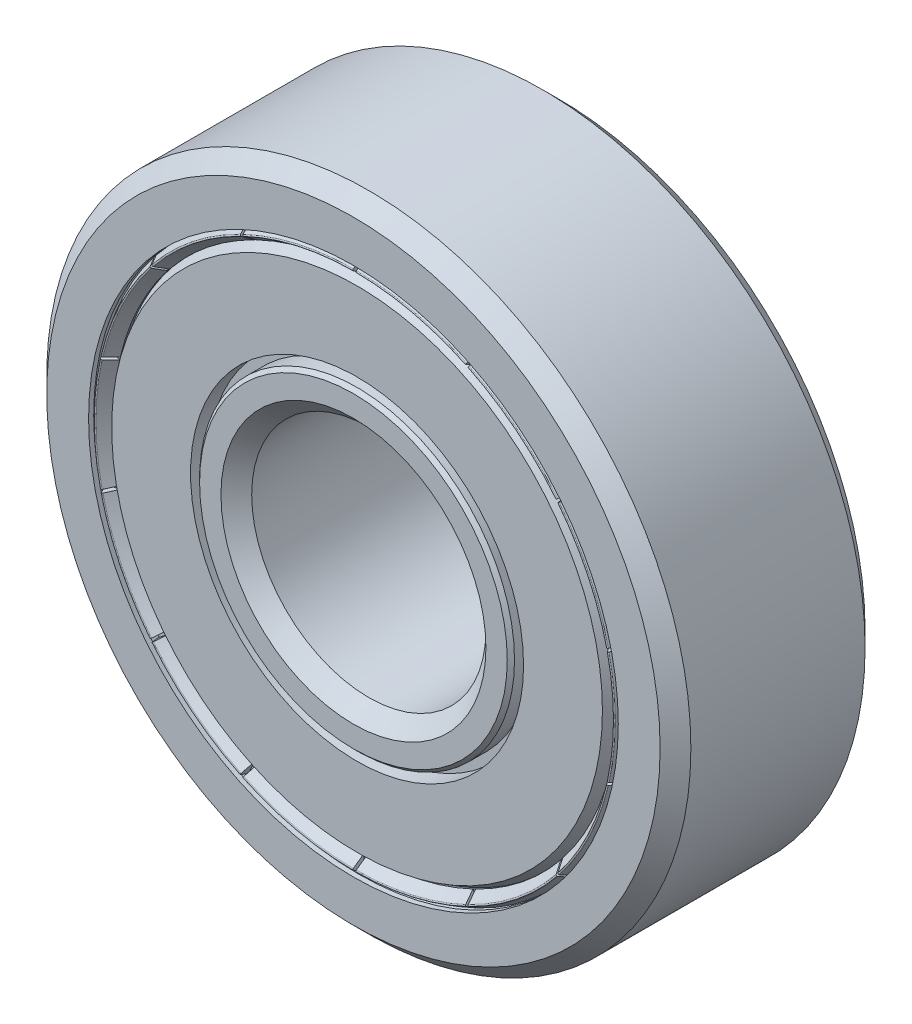
from build123d import *

# Parameters (mm, degrees)
CIRPATTERN1_COUNT  = 7
FILLET1_R          = 0.035
CUT_EXTRUDE1_START = 3.094142
CUT_EXTRUDE1_DEPTH = 13.851076719
CIRPATTERN2_COUNT  = 14


with BuildPart() as part:
    # Sketch3 → Revolve1 (revolve)
    with BuildSketch(Plane(origin=(0, 0, 0), x_dir=(0, 0, -1), z_dir=(1, 0, 0)), mode=Mode.PRIVATE) as revolve1_sk:
        with BuildLine():
            Line((2.975, 11), (-2.975, 11))
            Line((-2.975, 11), (-3.5, 10.475))
            Line((-3.5, 10.475), (-3.5, 9.046037105))
            Line((-3.5, 9.046037105), (-3.325, 9.046037105))
            Line((-3.325, 9.046037105), (-3.325, 9.498018553))
            Line((-3.325, 9.498018553), (-3.201256313, 9.621762239))
            Line((-3.201256313, 9.621762239), (-1.225, 9.621762239))
            ThreePointArc((-1.225, 9.621762239), (0, 9.95), (1.225, 9.621762239))
            Line((1.225, 9.621762239), (3.201256313, 9.621762239))
            Line((3.201256313, 9.621762239), (3.325, 9.498018553))
            Line((3.325, 9.498018553), (3.325, 9.046037105))
            Line((3.325, 9.046037105), (3.5, 9.046037105))
            Line((3.5, 9.046037105), (3.5, 10.475))
            Line((3.5, 10.475), (2.975, 11))
        make_face()
        with BuildLine():
            Line((2.975, 4), (-2.975, 4))
            Line((-2.975, 4), (-3.5, 4.525))
            Line((-3.5, 4.525), (-3.5, 5.254494074))
            Line((-3.5, 5.254494074), (-3.376256313, 5.378237761))
            Line((-3.376256313, 5.378237761), (-1.225, 5.378237761))
            ThreePointArc((-1.225, 5.378237761), (0, 5.05), (1.225, 5.378237761))
            Line((1.225, 5.378237761), (3.376256313, 5.378237761))
            Line((3.376256313, 5.378237761), (3.5, 5.254494074))
            Line((3.5, 5.254494074), (3.5, 4.525))
            Line((3.5, 4.525), (2.975, 4))
        make_face()
    revolve(revolve1_sk.sketch.rotate(Axis((0, 0, 3.5), (0, 0, -1)), 90), axis=Axis((0, 0, 3.5), (0, 0, -1)))


with BuildPart() as body_2:
    # Sketch4 → Revolve2 (revolve)
    with BuildSketch(Plane(origin=(0, 0, 0), x_dir=(0, 0, -1), z_dir=(1, 0, 0))):
        with BuildLine():
            Line((0, 9.95), (0, 5.05))
            ThreePointArc((0, 5.05), (-2.45, 7.5), (0, 9.95))
        make_face()
    revolve(axis=Axis((0, 11, 0), (0, -1, 0)))


with BuildPart() as cirpattern1_1:
    # CirPattern1: pattern copy
    add(body_2.part.rotate(Axis((0, 0, 0), (0, 0, 1)), 1 * 360 / CIRPATTERN1_COUNT))


with BuildPart() as cirpattern1_2:
    # CirPattern1: pattern copy
    add(body_2.part.rotate(Axis((0, 0, 0), (0, 0, 1)), 2 * 360 / CIRPATTERN1_COUNT))


with BuildPart() as cirpattern1_3:
    # CirPattern1: pattern copy
    add(body_2.part.rotate(Axis((0, 0, 0), (0, 0, 1)), 3 * 360 / CIRPATTERN1_COUNT))


with BuildPart() as cirpattern1_4:
    # CirPattern1: pattern copy
    add(body_2.part.rotate(Axis((0, 0, 0), (0, 0, 1)), 4 * 360 / CIRPATTERN1_COUNT))


with BuildPart() as cirpattern1_5:
    # CirPattern1: pattern copy
    add(body_2.part.rotate(Axis((0, 0, 0), (0, 0, 1)), 5 * 360 / CIRPATTERN1_COUNT))


with BuildPart() as cirpattern1_6:
    # CirPattern1: pattern copy
    add(body_2.part.rotate(Axis((0, 0, 0), (0, 0, 1)), 6 * 360 / CIRPATTERN1_COUNT))


with BuildPart() as body_9:
    # Sketch5 → Revolve3 (revolve)
    with BuildSketch(Plane(origin=(0, 0, 0), x_dir=(0, 0, -1), z_dir=(1, 0, 0)), mode=Mode.PRIVATE) as revolve3_sk:
        Polygon((-2.45, 5.378237761), (-2.758752104, 5.378237761), (-2.758752104, 5.686989865), (-3.376256313, 5.686989865), (-3.376256313, 8.380768779), (-2.758752104, 8.737285001), (-2.45, 8.737285001), align=None)
        Polygon((2.758752104, 8.737285001), (2.45, 8.737285001), (2.45, 5.378237761), (2.758752104, 5.378237761), (2.758752104, 5.686989865), (3.376256313, 5.686989865), (3.376256313, 8.380768779), align=None)
    revolve(revolve3_sk.sketch.rotate(Axis((0, 0, 3.5), (0, 0, -1)), 90), axis=Axis((0, 0, 3.5), (0, 0, -1)))


with BuildPart() as body_10:
    # Sketch6 → Revolve4 (revolve)
    with BuildSketch(Plane(origin=(0, 0, 0), x_dir=(0, 0, -1), z_dir=(1, 0, 0)), mode=Mode.PRIVATE) as revolve4_sk:
        Polygon((-2.994533294, 9.046037105), (-3.19375, 9.046037105), (-3.5, 8.869223585), (-3.099533294, 8.588813779), (-3.064533294, 8.588813779), (-2.994533294, 8.601156667), align=None)
    revolve(revolve4_sk.sketch.rotate(Axis((0, 0, 3.5), (0, 0, -1)), 90), axis=Axis((0, 0, 3.5), (0, 0, -1)))

    # Fillet1
    fillet1_edges = [body_10.edges().sort_by_distance(p)[0] for p in [
        (-8.869223585, 0, 3.5),
    ]]
    fillet(fillet1_edges, radius=FILLET1_R)

    # Sketch7 → Cut-Extrude1 (cut, through all)
    with BuildSketch(Plane.XY.offset(CUT_EXTRUDE1_START)):
        Polygon((-0.05, 9.046037105), (-0.05, 9.146037105), (0.05, 9.146037105), (0.05, 9.046037105), (0.05, 8.588813779), (0.05, 8.488813779), (-0.05, 8.488813779), (-0.05, 8.588813779), align=None)
    cut_extrude1 = extrude(amount=CUT_EXTRUDE1_DEPTH, mode=Mode.SUBTRACT)

    # CirPattern2: Cut-Extrude1 ×14 about axis
    cirpattern2_axis = Axis((0, 0, 0), (0, 0, 1))
    for i in range(1, CIRPATTERN2_COUNT):
        add(cut_extrude1.rotate(cirpattern2_axis, i * 360 / CIRPATTERN2_COUNT), mode=Mode.SUBTRACT)


with BuildPart() as body_11:
    # Mirror1: mirrored copy
    add(body_10.part.mirror(Plane.XY))


solid = Compound([part.part, body_2.part, cirpattern1_1.part, cirpattern1_2.part, cirpattern1_3.part, cirpattern1_4.part, cirpattern1_5.part, cirpattern1_6.part, body_9.part, body_10.part, body_11.part])
